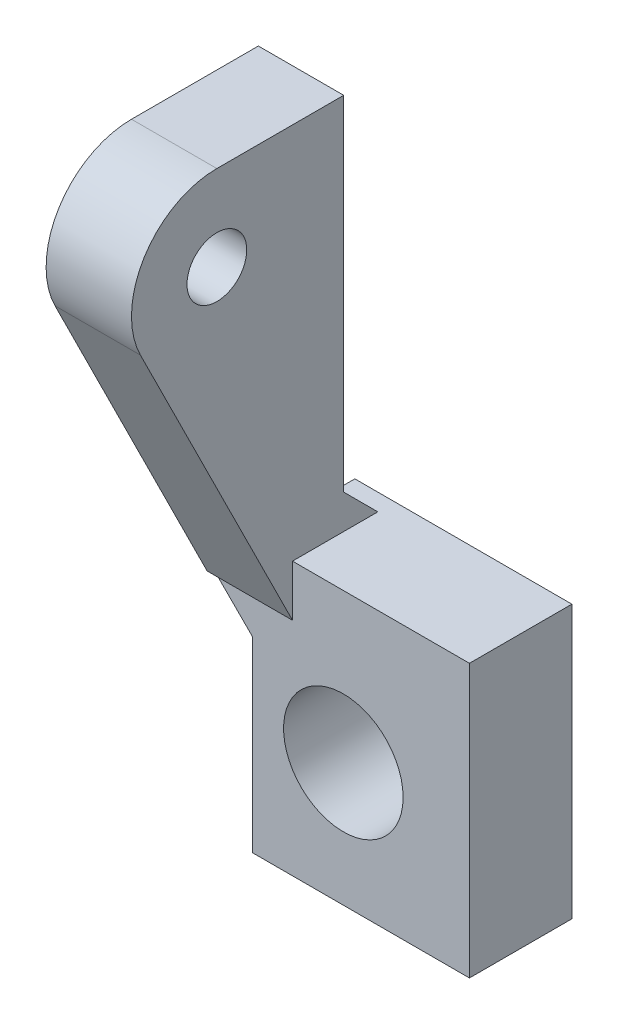
from build123d import *

# Parameters (mm, degrees)
SKETCH1_W           = 12.710924787
SKETCH1_H           = 15.963552005
SKETCH1_R           = 1.8
BOSS_EXTRUDE1_DEPTH = 1
SKETCH2_R           = 1.75
BOSS_EXTRUDE2_DEPTH = 5
SKETCH3_R           = 3.5
BOSS_EXTRUDE3_DEPTH = 5
CHAMFER1_SIZE       = 2


with BuildPart() as part:
    # Sketch1 → Boss-Extrude1 (new body)
    with BuildSketch(Plane.XY.offset(46.41148)):
        with Locations((39.508303211, 7.326783953)):
            Rectangle(SKETCH1_W, SKETCH1_H)
        with Locations((38.478852397, 6.566573863)):
            Circle(SKETCH1_R, mode=Mode.SUBTRACT)
    extrude(amount=BOSS_EXTRUDE1_DEPTH)

    # Sketch2 → Boss-Extrude2 (add)
    with BuildSketch(Plane(origin=(30.5, 0, 0), x_dir=(0, 0, -1), z_dir=(1, 0, 0))):
        with BuildLine():
            Line((-56.841529107, 37.437587441), (-49.41148, 37.437587441))
            Line((-49.41148, 37.437587441), (-49.41148, 17.308559955))
            Line((-49.41148, 17.308559955), (-47.41148, 15.308559955))
            Line((-47.41148, 15.308559955), (-47.41148, 12.308559955))
            Line((-47.41148, 12.308559955), (-52.41148, 12.308559955))
            Line((-52.41148, 12.308559955), (-61.318087937, 30.210387171))
            ThreePointArc((-61.318087937, 30.210387171), (-61.092176196, 35.07045647), (-56.841529107, 37.437587441))
        make_face()
        with Locations((-56.841529107, 32.437587441)):
            Circle(SKETCH2_R, mode=Mode.SUBTRACT)
    extrude(amount=BOSS_EXTRUDE2_DEPTH)

    # Sketch3 → Boss-Extrude3 (add)
    with BuildSketch(Plane.XY.offset(47.41148)):
        Polygon((35.5, 15.308559955), (35.5, 12.308559955), (33.152840817, 12.308559955), (33.152840817, -0.65499205), (45.863765604, -0.65499205), (45.863765604, 15.308559955), align=None)
        with Locations((38.478852397, 6.566573863)):
            Circle(SKETCH3_R, mode=Mode.SUBTRACT)
    extrude(amount=BOSS_EXTRUDE3_DEPTH)

    # Chamfer1
    chamfer1_edges = [part.edges().sort_by_distance(p)[0] for p in [
        (33.152840817, 12.308559955, 49.91148),
    ]]
    chamfer(chamfer1_edges, length=CHAMFER1_SIZE)


solid = part.part
